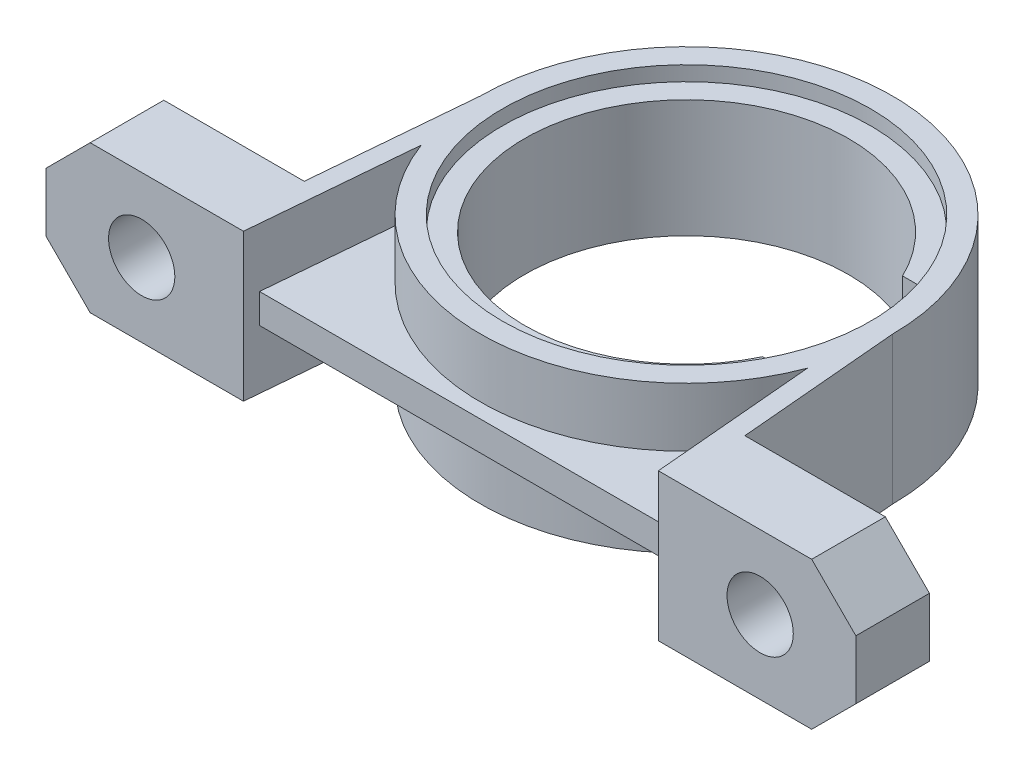
from build123d import *

# Parameters (mm, degrees)
BOSS_EXTRU_1_DEPTH      = 10
ESQUISSE3_R             = 2.25
ENL_V_MAT_EXTRU_1_DEPTH = 5
ESQUISSE5_R             = 11
ENL_V_MAT_EXTRU_2_DEPTH = 10
ESQUISSE6_R             = 12.5
ENL_V_MAT_EXTRU_3_DEPTH = 1
ENL_V_START             = -1
ESQUISSE7_R             = 12.5
ENL_V_MAT_EXTRU_4_DEPTH = 1
ENL_V_MAT_EXTRU_5_DEPTH = 5
ENL_V_START_2           = -4
ENL_V_MAT_EXTRU_6_DEPTH = 4
ENL_V_MAT_EXTRU_7_DEPTH = 4


with BuildPart() as part:
    # Esquisse2 → Boss.-Extru.1 (new body)
    with BuildSketch(Plane(origin=(0, 0, 0), x_dir=(1, 0, 0), z_dir=(0, 1, 0))):
        with BuildLine():
            Line((14.087488664, 0), (27.5, 0))
            Line((27.5, 0), (27.5, 5))
            Line((27.5, 5), (14.962375299, 5))
            Line((14.962375299, 5), (14, 16))
            ThreePointArc((14, 16), (0, 30), (-14, 16))
            Line((-14, 16), (-14.962375299, 5))
            Line((-14.962375299, 5), (-27.5, 5))
            Line((-27.5, 5), (-27.5, 0))
            Line((-27.5, 0), (-14.087488664, 0))
            Line((-14.087488664, 0), (-14, 1))
            Line((-14, 1), (14, 1))
            Line((14, 1), (14.087488664, 0))
        make_face()
    extrude(amount=BOSS_EXTRU_1_DEPTH)

    # Esquisse3 → Enlèv. mat.-Extru.1 (cut)
    with BuildSketch(Plane.XY):
        with Locations((-21, 5)):
            Circle(ESQUISSE3_R)
        with Locations((21, 5)):
            Circle(ESQUISSE3_R)
        Polygon((-27.5, 3), (-24.5, 0), (-27.5, 0), align=None)
        Polygon((-27.5, 10), (-27.5, 7), (-24.5, 10), align=None)
        Polygon((27.5, 7), (24.5, 10), (27.5, 10), align=None)
        Polygon((27.5, 3), (24.5, 0), (27.5, 0), align=None)
    extrude(amount=-ENL_V_MAT_EXTRU_1_DEPTH, mode=Mode.SUBTRACT)

    # Esquisse5 → Enlèv. mat.-Extru.2 (cut)
    with BuildSketch(Plane(origin=(0, 10, 0), x_dir=(1, 0, 0), z_dir=(0, 1, 0))):
        with Locations(Location((0, 16, 0), (0, 0, 270))):
            Circle(ESQUISSE5_R)
    extrude(amount=-ENL_V_MAT_EXTRU_2_DEPTH, mode=Mode.SUBTRACT)

    # Esquisse6 → Enlèv. mat.-Extru.3 (cut)
    with BuildSketch(Plane(origin=(0, 10, 0), x_dir=(1, 0, 0), z_dir=(0, 1, 0))):
        with Locations(Location((0, 16, 0), (0, 0, 270))):
            Circle(ESQUISSE6_R)
    extrude(amount=-ENL_V_MAT_EXTRU_3_DEPTH, mode=Mode.SUBTRACT)

    # Esquisse7 → Enlèv. mat.-Extru.4 (cut)
    with BuildSketch(Plane.XZ.offset(ENL_V_START)):
        with Locations(Location((0, -16, 0), (0, 0, 90))):
            Circle(ESQUISSE7_R)
    extrude(amount=ENL_V_MAT_EXTRU_4_DEPTH, mode=Mode.SUBTRACT)

    # Esquisse8 → Enlèv. mat.-Extru.5 (cut)
    with BuildSketch(Plane(origin=(0, 9, 0), x_dir=(1, 0, 0), z_dir=(0, 1, 0))):
        with BuildLine():
            Line((11.56233108, 20.75), (9.921567416, 20.75))
            ThreePointArc((9.921567416, 20.75), (11, 16), (9.921567416, 11.25))
            Line((9.921567416, 11.25), (11.56233108, 11.25))
            ThreePointArc((11.56233108, 11.25), (12.5, 16), (11.56233108, 20.75))
        make_face()
    extrude(amount=-ENL_V_MAT_EXTRU_5_DEPTH, mode=Mode.SUBTRACT)

    # Esquisse9 → Enlèv. mat.-Extru.6 (cut)
    with BuildSketch(Plane(origin=(0, 10, 0), x_dir=(1, 0, 0), z_dir=(0, 1, 0)).offset(ENL_V_START_2)):
        with BuildLine():
            Line((14, 1), (13.116009813, 11.104054068))
            ThreePointArc((13.116009813, 11.104054068), (0, 2), (-13.116009813, 11.104054068))
            Line((-13.116009813, 11.104054068), (-14, 1))
            Line((-14, 1), (14, 1))
        make_face()
    extrude(amount=ENL_V_MAT_EXTRU_6_DEPTH, mode=Mode.SUBTRACT)

    # Esquisse10 → Enlèv. mat.-Extru.7 (cut)
    with BuildSketch(Plane.XZ):
        with BuildLine():
            Line((13.116009813, -11.104054068), (14, -1))
            Line((14, -1), (-14, -1))
            Line((-14, -1), (-13.116009813, -11.104054068))
            ThreePointArc((-13.116009813, -11.104054068), (0, -2), (13.116009813, -11.104054068))
        make_face()
    extrude(amount=-ENL_V_MAT_EXTRU_7_DEPTH, mode=Mode.SUBTRACT)


solid = part.part
